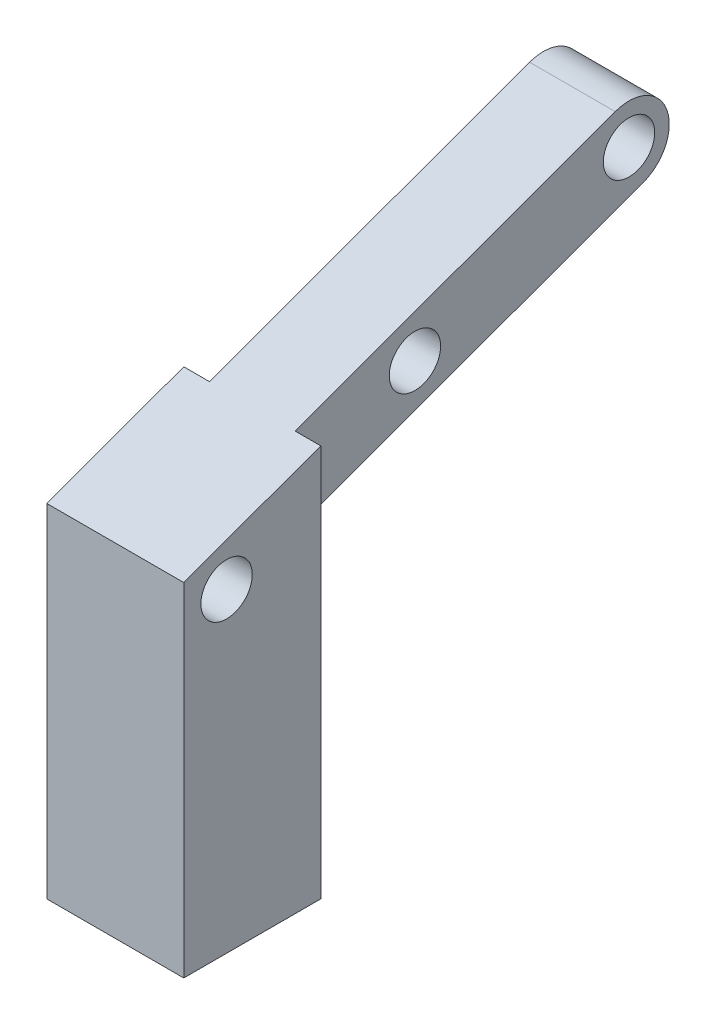
from build123d import *

# Parameters (mm, degrees)
SKETCH_1_W               = 8
SKETCH_1_H               = 8
EXTRUDE_1_DEPTH          = 20
EXTRUDE_2_DEPTH          = 2.5
CUT_EXTRUDE_1_DEPTH      = 41.91749234
CUT_EXTRUDE_1_DEPTH_BACK = 41.91749234
SKETCH_4_R               = 1.5
CUT_EXTRUDE_2_DEPTH      = 41.91749234
SKETCH_9_R               = 1.3
CUT_EXTRUDE_3_DEPTH      = 10
EXTRUDE_3_DEPTH          = 8
CUT_EXTRUDE_START        = -4
CUT_EXTRUDE_4_DEPTH      = 3.55


with BuildPart() as part:
    # 草图1 → 凸台-拉伸1 (new body)
    with BuildSketch(Plane(origin=(0, 0, 0), x_dir=(1, 0, 0), z_dir=(0, 1, 0))):
        Rectangle(SKETCH_1_W, SKETCH_1_H)
    extrude(amount=EXTRUDE_1_DEPTH)

    # 草图2 → 凸台-拉伸2 (add, symmetric)
    with BuildSketch(Plane(origin=(0, 0, 0), x_dir=(0, 0, -1), z_dir=(1, 0, 0))):
        Polygon((-4, 20), (26, 30.919107028), (26, 25.919107028), (-4, 15), align=None)
    extrude(amount=EXTRUDE_2_DEPTH, both=True)

    # 草图4 → 切除-拉伸1 (cut, two sides: drawn at the far end of the back side and taken through both)
    with BuildSketch(Plane(origin=(2.5, 0, 0), x_dir=(0, 0, -1), z_dir=(1, 0, 0)).offset(-CUT_EXTRUDE_1_DEPTH_BACK)):
        with Locations((-1.5, 18.409925586)):
            Circle(SKETCH_4_R)
        with Locations((23.5, 27.509181442)):
            Circle(SKETCH_4_R)
        with Locations((11, 22.959553514)):
            Circle(SKETCH_4_R)
    extrude(amount=CUT_EXTRUDE_1_DEPTH + CUT_EXTRUDE_1_DEPTH_BACK, mode=Mode.SUBTRACT)

    # 草图7 → 切除-拉伸2 (cut, through all)
    with BuildSketch(Plane.ZY.offset(2.5)):
        with BuildLine():
            Line((-26, 30.919107028), (-26, 25.919107028))
            Line((-26, 25.919107028), (-24.303484649, 25.301625938))
            ThreePointArc((-24.303484649, 25.301625938), (-25.707555519, 28.312666051), (-22.696515431, 29.716736975))
            Line((-22.696515431, 29.716736975), (-26, 30.919107028))
        make_face()
    extrude(amount=-CUT_EXTRUDE_2_DEPTH, mode=Mode.SUBTRACT)

    # 草图9 → 切除-拉伸3 (cut)
    with BuildSketch(Plane.XZ):
        with Locations(Location((0, 0, 0), (0, 0, 270))):
            Circle(SKETCH_9_R)
    extrude(amount=-CUT_EXTRUDE_3_DEPTH, mode=Mode.SUBTRACT)

    # 草图11 → 凸台-拉伸3 (add)
    with BuildSketch(Plane(origin=(4, 0, 0), x_dir=(0, 0, -1), z_dir=(1, 0, 0))):
        Polygon((-4, 20), (4, 20), (4, 22.911761874), align=None)
    extrude(amount=-EXTRUDE_3_DEPTH)

    # 草图12 → 切除-拉伸4 (cut)
    with BuildSketch(Plane.XZ.offset(CUT_EXTRUDE_START)):
        Polygon((2.840563324, 0), (1.420281662, 2.46), (-1.420281662, 2.46), (-2.840563324, 0), (-1.420281662, -2.46), (1.420281662, -2.46), align=None)
    extrude(amount=-CUT_EXTRUDE_4_DEPTH, mode=Mode.SUBTRACT)


solid = part.part
